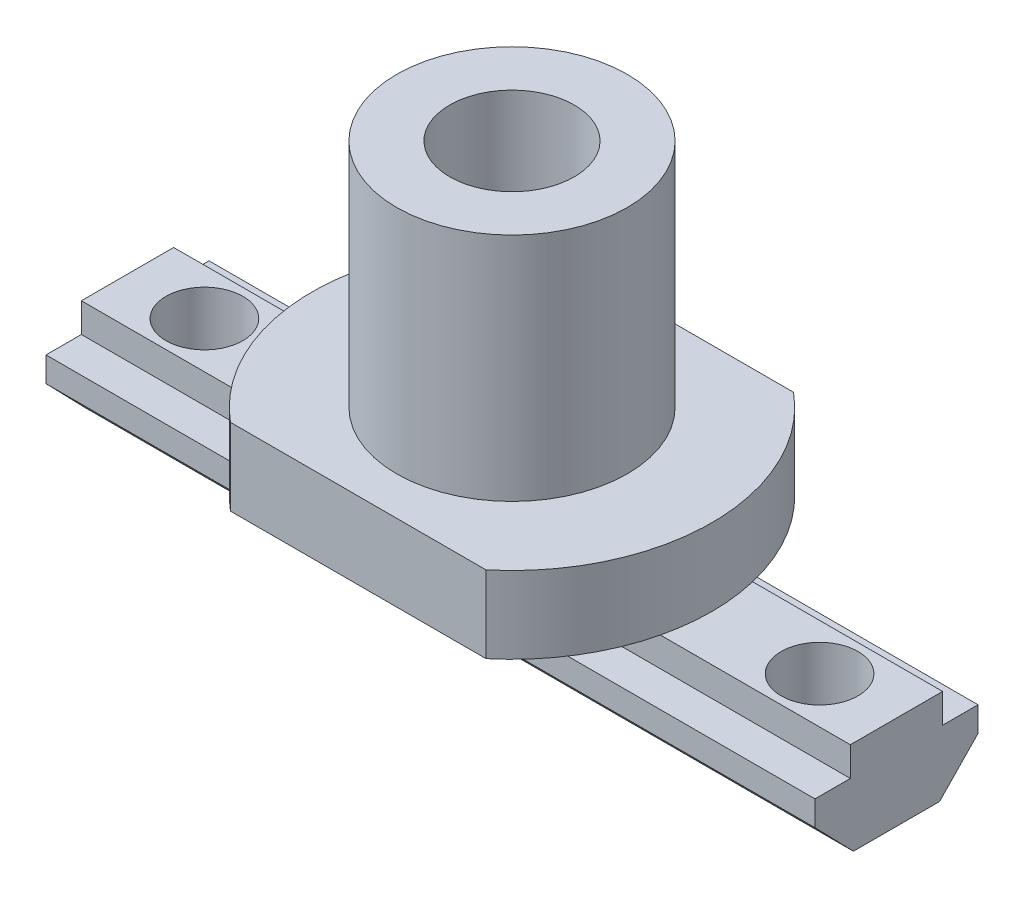
from build123d import *

# Parameters (mm, degrees)
BOSS_EXTRUDE1_DEPTH = 25
BOSS_EXTRUDE3_DEPTH = 5
SKETCH6_R           = 7.5
BOSS_EXTRUDE4_DEPTH = 15
SKETCH7_R           = 4.05
CUT_EXTRUDE1_DEPTH  = 20
SKETCH8_R           = 2.5
CUT_EXTRUDE2_DEPTH  = 34.541019662


with BuildPart() as part:
    # Sketch2 → Boss-Extrude1 (new, symmetric)
    with BuildSketch(Plane(origin=(0, 0, 0), x_dir=(0, 0, -1), z_dir=(1, 0, 0))):
        Polygon((-3, 6.1), (3, 6.1), (3, 4.2), (5.3, 4.2), (5.3, 2.58), (2.8, 0), (-2.8, 0), (-5.3, 2.58), (-5.3, 4.2), (-3, 4.2), align=None)
    extrude(amount=BOSS_EXTRUDE1_DEPTH, both=True)

    # Sketch5 → Boss-Extrude3 (add)
    with BuildSketch(Plane(origin=(0, 6.1, 0), x_dir=(1, 0, 0), z_dir=(0, 1, 0))):
        with BuildLine():
            Line((8.306623863, -10), (-8.306623863, -10))
            ThreePointArc((-8.306623863, -10), (-13, 0), (-8.306623863, 10))
            Line((-8.306623863, 10), (8.306623863, 10))
            ThreePointArc((8.306623863, 10), (13, 0), (8.306623863, -10))
        make_face()
    extrude(amount=BOSS_EXTRUDE3_DEPTH)

    # Sketch6 → Boss-Extrude4 (add)
    with BuildSketch(Plane(origin=(0, 11.1, 0), x_dir=(1, 0, 0), z_dir=(0, 1, 0))):
        with Locations(Location((0, 0, 0), (0, 0, 270))):
            Circle(SKETCH6_R)
    extrude(amount=BOSS_EXTRUDE4_DEPTH)

    # Sketch7 → Cut-Extrude1 (cut)
    with BuildSketch(Plane(origin=(0, 26.1, 0), x_dir=(1, 0, 0), z_dir=(0, 1, 0))):
        with Locations(Location((0, 0, 0), (0, 0, 270))):
            Circle(SKETCH7_R)
    extrude(amount=-CUT_EXTRUDE1_DEPTH, mode=Mode.SUBTRACT)

    # Sketch8 → Cut-Extrude2 (cut, through all)
    with BuildSketch(Plane(origin=(0, 6.1, 0), x_dir=(1, 0, 0), z_dir=(0, 1, 0))):
        with Locations(Location((20, 0, 0), (0, 0, 270))):
            Circle(SKETCH8_R)
        with Locations(Location((-20, 0, 0), (0, 0, 270))):
            Circle(SKETCH8_R)
    extrude(amount=-CUT_EXTRUDE2_DEPTH, mode=Mode.SUBTRACT)


solid = part.part
